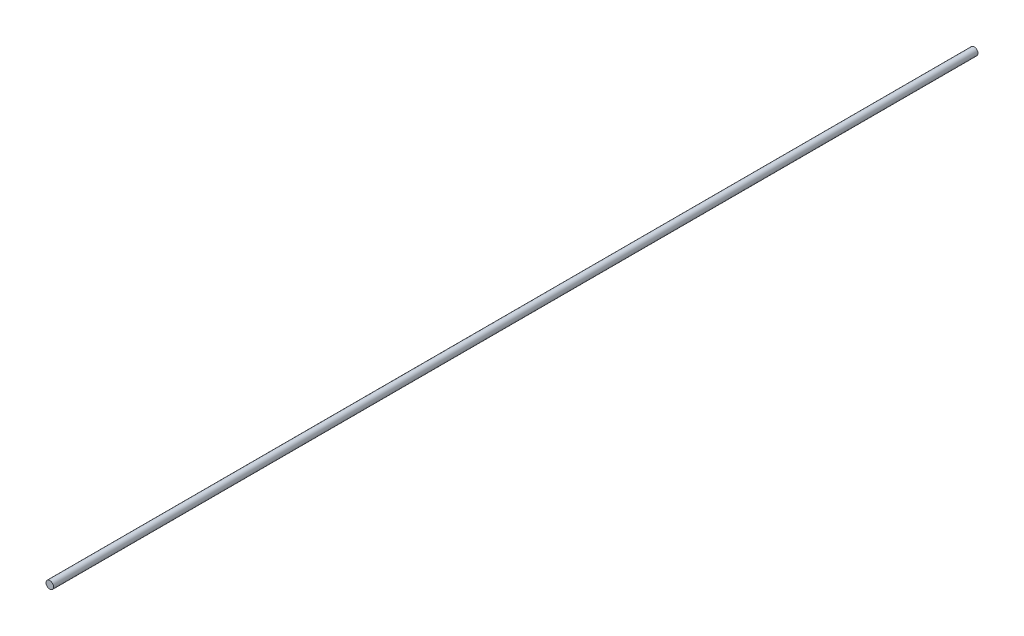
from build123d import *

# Parameters (mm, degrees)
SKETCH1_R           = 2.5
BOSS_EXTRUDE1_DEPTH = 610


with BuildPart() as part:
    # Sketch1 → Boss-Extrude1 (new body)
    with BuildSketch(Plane.XY):
        Circle(SKETCH1_R)
    extrude(amount=BOSS_EXTRUDE1_DEPTH)


solid = part.part
